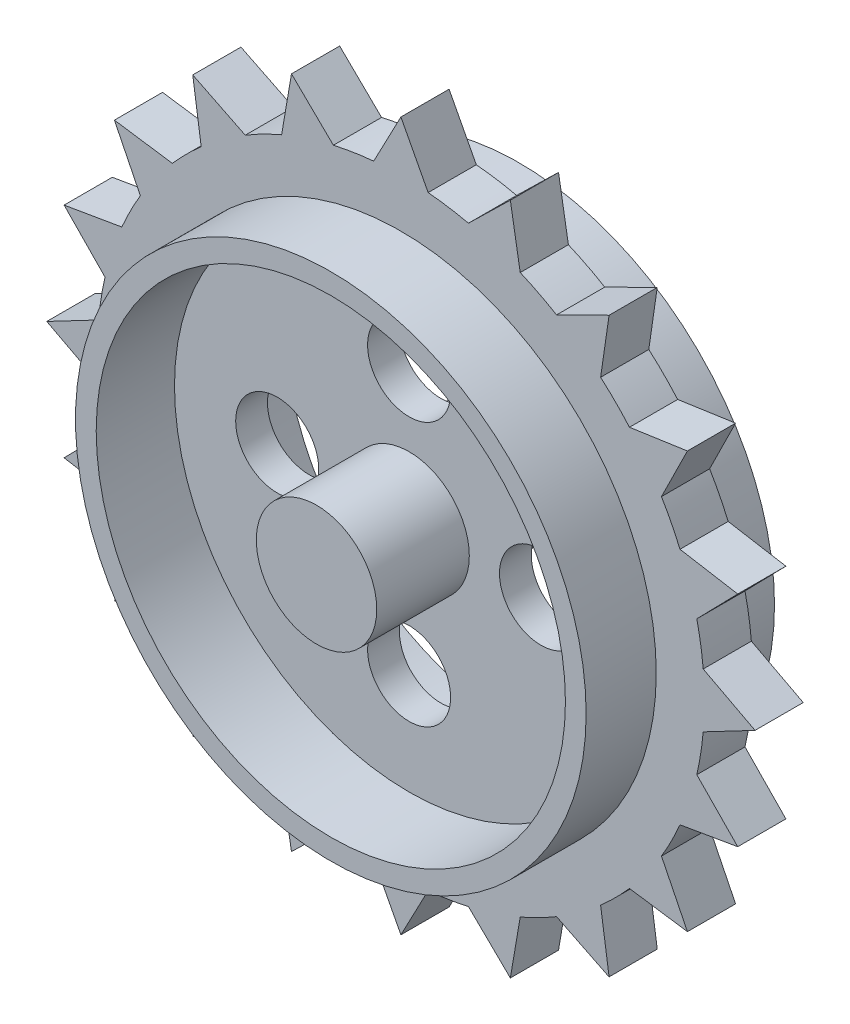
from build123d import *

# Parameters (mm, degrees)
CUT_EXTRUDE2_DEPTH  = 17.78
SKETCH4_R           = 2.189434211
CUT_EXTRUDE3_DEPTH  = 1.6764
BOSS_EXTRUDE1_DEPTH = 2.54
SKETCH6_R           = 12.3698
CUT_EXTRUDE4_DEPTH  = 29.485557153


with BuildPart() as part:
    # Sketch1 → Revolve1 (revolve)
    with BuildSketch(Plane(origin=(0, 0, 0), x_dir=(0, 0, -1), z_dir=(1, 0, 0)), mode=Mode.PRIVATE) as revolve1_sk:
        Polygon((4.9657, 13.462), (1.27, 13.462), (1.27, 16.002), (-1.27, 16.002), (-1.27, 13.462), (-4.9657, 13.462), (-4.9657, 12.3698), (-0.8382, 12.3698), (-0.8382, 3.175), (-5.719832453, 3.175), (-5.719832453, 0), (0, 0), (14.625567547, 0), (14.625567547, 3.175), (0.8382, 3.175), (0.8382, 12.3698), (4.9657, 12.3698), align=None)
    revolve(revolve1_sk.sketch.rotate(Axis((0, 0, 0), (0, 0, -1)), 90), axis=Axis((0, 0, 0), (0, 0, -1)))

    # Sketch3 → Cut-Extrude2 (cut)
    with BuildSketch(Plane(origin=(0, 0, -14.625567547), x_dir=(-1, 0, 0), z_dir=(0, 0, -1))):
        Polygon((1.539793168, 0), (0.769896584, 1.3335), (-0.769896584, 1.3335), (-1.539793168, 0), (-0.769896584, -1.3335), (0.769896584, -1.3335), align=None)
    extrude(amount=-CUT_EXTRUDE2_DEPTH, mode=Mode.SUBTRACT)

    # Sketch4 → Cut-Extrude3 (cut)
    with BuildSketch(Plane(origin=(0, 0, -0.8382), x_dir=(-1, 0, 0), z_dir=(0, 0, -1))):
        with Locations((0, 6.954565789)):
            Circle(SKETCH4_R)
        with Locations((6.954565789, 0)):
            Circle(SKETCH4_R)
        with Locations((0, -6.954565789)):
            Circle(SKETCH4_R)
        with Locations((-6.954565789, 0)):
            Circle(SKETCH4_R)
    extrude(amount=-CUT_EXTRUDE3_DEPTH, mode=Mode.SUBTRACT)

    # Sketch5 → Boss-Extrude1 (add)
    with BuildSketch(Plane.XY.offset(1.27)):
        with BuildLine():
            ThreePointArc((-13.73725383, 8.206817971), (-12.945889944, 9.405739607), (-12.050192599, 10.528858548))
            Line((-12.050192599, 10.528858548), (-15.10552331, 10.974805092))
            Line((-15.10552331, 10.974805092), (-13.73725383, 8.206817971))
        make_face()
        with BuildLine():
            ThreePointArc((-10.528858548, 12.050192599), (-9.405739607, 12.945889944), (-8.206817971, 13.73725383))
            Line((-8.206817971, 13.73725383), (-10.974805092, 15.10552331))
            Line((-10.974805092, 15.10552331), (-10.528858548, 12.050192599))
        make_face()
        with BuildLine():
            ThreePointArc((-6.289825233, 14.714010417), (-4.944889944, 15.218806374), (-3.56010282, 15.600950994))
            Line((-3.56010282, 15.600950994), (-5.769796486, 17.757607659))
            Line((-5.769796486, 17.757607659), (-6.289825233, 14.714010417))
        make_face()
        with BuildLine():
            ThreePointArc((-1.4351, 15.937518376), (0, 16.002), (1.4351, 15.937518376))
            Line((1.4351, 15.937518376), (0, 18.671453646))
            Line((0, 18.671453646), (-1.4351, 15.937518376))
        make_face()
        with BuildLine():
            ThreePointArc((3.56010282, 15.600950994), (4.944889944, 15.218806374), (6.289825233, 14.714010417))
            Line((6.289825233, 14.714010417), (5.769796486, 17.757607659))
            Line((5.769796486, 17.757607659), (3.56010282, 15.600950994))
        make_face()
        with BuildLine():
            ThreePointArc((8.206817971, 13.73725383), (9.405739607, 12.945889944), (10.528858548, 12.050192599))
            Line((10.528858548, 12.050192599), (10.974805092, 15.10552331))
            Line((10.974805092, 15.10552331), (8.206817971, 13.73725383))
        make_face()
        with BuildLine():
            ThreePointArc((12.050192599, 10.528858548), (12.945889944, 9.405739607), (13.73725383, 8.206817971))
            Line((13.73725383, 8.206817971), (15.10552331, 10.974805092))
            Line((15.10552331, 10.974805092), (12.050192599, 10.528858548))
        make_face()
        with BuildLine():
            ThreePointArc((14.714010417, 6.289825233), (15.218806374, 4.944889944), (15.600950994, 3.56010282))
            Line((15.600950994, 3.56010282), (17.757607659, 5.769796486))
            Line((17.757607659, 5.769796486), (14.714010417, 6.289825233))
        make_face()
        with BuildLine():
            Line((18.671453646, 0), (16.002, 0))
            ThreePointArc((16.002, 0), (15.985871466, -0.718273954), (15.937518376, -1.4351))
            Line((15.937518376, -1.4351), (18.671453646, 0))
        make_face()
        with BuildLine():
            ThreePointArc((15.937518376, 1.4351), (15.985871466, 0.718273954), (16.002, 0))
            Line((16.002, 0), (18.671453646, 0))
            Line((18.671453646, 0), (15.937518376, 1.4351))
        make_face()
        with BuildLine():
            Line((17.757607659, -5.769796486), (15.600950994, -3.56010282))
            ThreePointArc((15.600950994, -3.56010282), (15.218806374, -4.944889944), (14.714010417, -6.289825233))
            Line((14.714010417, -6.289825233), (17.757607659, -5.769796486))
        make_face()
        with BuildLine():
            Line((15.10552331, -10.974805092), (13.73725383, -8.206817971))
            ThreePointArc((13.73725383, -8.206817971), (12.945889944, -9.405739607), (12.050192599, -10.528858548))
            Line((12.050192599, -10.528858548), (15.10552331, -10.974805092))
        make_face()
        with BuildLine():
            Line((10.974805092, -15.10552331), (10.528858548, -12.050192599))
            ThreePointArc((10.528858548, -12.050192599), (9.405739607, -12.945889944), (8.206817971, -13.73725383))
            Line((8.206817971, -13.73725383), (10.974805092, -15.10552331))
        make_face()
        with BuildLine():
            Line((5.769796486, -17.757607659), (6.289825233, -14.714010417))
            ThreePointArc((6.289825233, -14.714010417), (4.944889944, -15.218806374), (3.56010282, -15.600950994))
            Line((3.56010282, -15.600950994), (5.769796486, -17.757607659))
        make_face()
        with BuildLine():
            Line((0, -18.671453646), (1.4351, -15.937518376))
            ThreePointArc((1.4351, -15.937518376), (0, -16.002), (-1.4351, -15.937518376))
            Line((-1.4351, -15.937518376), (0, -18.671453646))
        make_face()
        with BuildLine():
            Line((-5.769796486, -17.757607659), (-3.56010282, -15.600950994))
            ThreePointArc((-3.56010282, -15.600950994), (-4.944889944, -15.218806374), (-6.289825233, -14.714010417))
            Line((-6.289825233, -14.714010417), (-5.769796486, -17.757607659))
        make_face()
        with BuildLine():
            Line((-10.974805092, -15.10552331), (-8.206817971, -13.73725383))
            ThreePointArc((-8.206817971, -13.73725383), (-9.405739607, -12.945889944), (-10.528858548, -12.050192599))
            Line((-10.528858548, -12.050192599), (-10.974805092, -15.10552331))
        make_face()
        with BuildLine():
            Line((-15.10552331, -10.974805092), (-12.050192599, -10.528858548))
            ThreePointArc((-12.050192599, -10.528858548), (-12.945889944, -9.405739607), (-13.73725383, -8.206817971))
            Line((-13.73725383, -8.206817971), (-15.10552331, -10.974805092))
        make_face()
        with BuildLine():
            Line((-17.757607659, -5.769796486), (-14.714010417, -6.289825233))
            ThreePointArc((-14.714010417, -6.289825233), (-15.218806374, -4.944889944), (-15.600950994, -3.56010282))
            Line((-15.600950994, -3.56010282), (-17.757607659, -5.769796486))
        make_face()
        with BuildLine():
            ThreePointArc((-15.937518376, -1.4351), (-16.002, 0), (-15.937518376, 1.4351))
            Line((-15.937518376, 1.4351), (-18.671453646, 0))
            Line((-18.671453646, 0), (-15.937518376, -1.4351))
        make_face()
        with BuildLine():
            ThreePointArc((-15.600950994, 3.56010282), (-15.218806374, 4.944889944), (-14.714010417, 6.289825233))
            Line((-14.714010417, 6.289825233), (-17.757607659, 5.769796486))
            Line((-17.757607659, 5.769796486), (-15.600950994, 3.56010282))
        make_face()
    extrude(amount=-BOSS_EXTRUDE1_DEPTH)

    # Sketch6 → Cut-Extrude4 (cut, through all)
    with BuildSketch(Plane(origin=(0, 0, -4.9657), x_dir=(-1, 0, 0), z_dir=(0, 0, -1))):
        with Locations(Location((0, 0, 0), (0, 0, 180))):
            Circle(SKETCH6_R)
    extrude(amount=CUT_EXTRUDE4_DEPTH, mode=Mode.SUBTRACT)


solid = part.part
